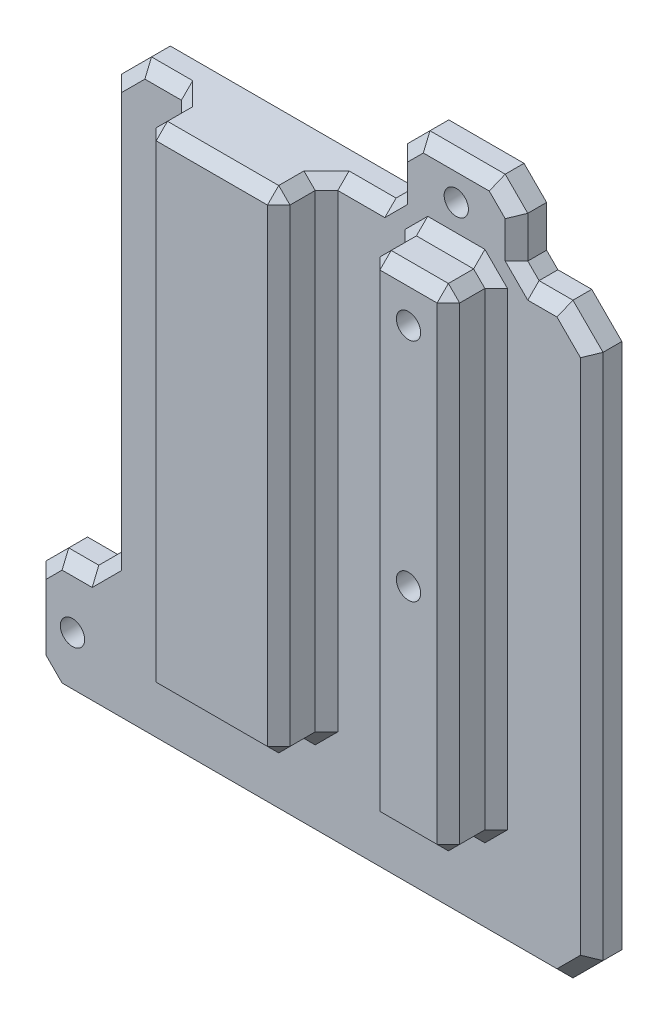
from build123d import *

# Parameters (mm, degrees)
SKETCH1_W                    = 32
SKETCH1_H                    = 39
BOSS_EXTRUDE1_DEPTH          = 2
SKETCH2_W                    = 5.3
SKETCH2_H                    = 32.65
SKETCH2_W_2                  = 8.89
BOSS_EXTRUDE2_DEPTH          = 3.175
SKETCH10_W                   = 8
SKETCH10_H                   = 5
SKETCH10_W_2                 = 5
SKETCH10_H_2                 = 8
BOSS_EXTRUDE3_DEPTH          = 2
F_52_0_0635_DIAMETER_HOLE1_D = 1.6129
CHAMFER1_SIZE                = 2
CHAMFER3_SIZE                = 1.5
CHAMFER2_SIZE                = 0.75


with BuildPart() as part:
    # Sketch1 → Boss-Extrude1 (new body)
    with BuildSketch(Plane.XY):
        with Locations((0, 157.8)):
            Rectangle(SKETCH1_W, SKETCH1_H)
    extrude(amount=BOSS_EXTRUDE1_DEPTH)

    # Sketch2 → Boss-Extrude2 (add)
    with BuildSketch(Plane.XY.offset(2)):
        with Locations((7, 160.975)):
            Rectangle(SKETCH2_W, SKETCH2_H)
        with Locations((-6.068, 160.975)):
            Rectangle(SKETCH2_W_2, SKETCH2_H)
    extrude(amount=BOSS_EXTRUDE2_DEPTH)

    # Sketch10 → Boss-Extrude3 (add)
    with BuildSketch(Plane.XY.offset(2)):
        with Locations((7, 179.8)):
            Rectangle(SKETCH10_W, SKETCH10_H)
        with Locations((-18.5, 142.3)):
            Rectangle(SKETCH10_W_2, SKETCH10_H_2)
    extrude(amount=-BOSS_EXTRUDE3_DEPTH)

    # #52 (0.0635) Diameter Hole1 (through all)
    with Locations(Plane.XY.offset(5.175)):
        with Locations((7, 174.3), (7, 159.3), (-18.5, 142.3), (7, 179.8)):
            Hole(F_52_0_0635_DIAMETER_HOLE1_D / 2)

    # Chamfer1
    chamfer1_edges = [part.edges().sort_by_distance(p)[0] for p in [
        (16, 177.3, 1),
        (16, 138.3, 1),
        (-16, 177.3, 1),
    ]]
    chamfer(chamfer1_edges, length=CHAMFER1_SIZE)

    # Chamfer3
    chamfer3_edges = [part.edges().sort_by_distance(p)[0] for p in [
        (11, 182.3, 1),
        (3, 182.3, 1),
        (-21, 146.3, 1),
        (-21, 138.3, 1),
        (-16, 146.3, 1),
    ]]
    chamfer(chamfer3_edges, length=CHAMFER3_SIZE)

    # Chamfer2
    chamfer2_edges = [part.edges().sort_by_distance(p)[0] for p in [
        (-21, 142.3, 2),
        (7, 182.3, 2),
        (3, 179.05, 2),
        (-18.5, 146.3, 2),
        (-2.75, 138.3, 2),
        (3.75, 181.55, 2),
        (10.25, 181.55, 2),
        (-20.25, 145.55, 2),
        (-20.25, 139.05, 2),
        (-16.75, 147.05, 2),
        (9.65, 160.975, 2),
        (9.65, 144.65, 3.5875),
        (9.65, 177.3, 3.5875),
        (4.35, 160.975, 2),
        (4.35, 177.3, 3.5875),
        (7, 144.65, 2),
        (4.35, 144.65, 3.5875),
        (9.65, 160.975, 5.175),
        (7, 177.3, 5.175),
        (4.35, 160.975, 5.175),
        (7, 144.65, 5.175),
        (-12.2565, 177.3, 2),
        (-1.623, 160.975, 2),
        (-1.623, 144.65, 3.5875),
        (-1.623, 177.3, 3.5875),
        (-10.513, 160.975, 2),
        (-10.513, 177.3, 3.5875),
        (-6.068, 144.65, 2),
        (-10.513, 144.65, 3.5875),
        (-1.623, 160.975, 5.175),
        (-6.068, 177.3, 5.175),
        (-10.513, 160.975, 5.175),
        (-6.068, 144.65, 5.175),
        (0.6885, 177.3, 2),
        (7, 177.3, 2),
        (11, 179.05, 2),
        (11, 177.3, 1),
        (3, 177.3, 1),
        (12.5, 177.3, 2),
        (16, 157.8, 2),
        (-16, 161.55, 2),
        (-15, 176.3, 2),
        (15, 139.3, 2),
        (15, 176.3, 2),
    ]]
    chamfer(chamfer2_edges, length=CHAMFER2_SIZE)


solid = part.part
